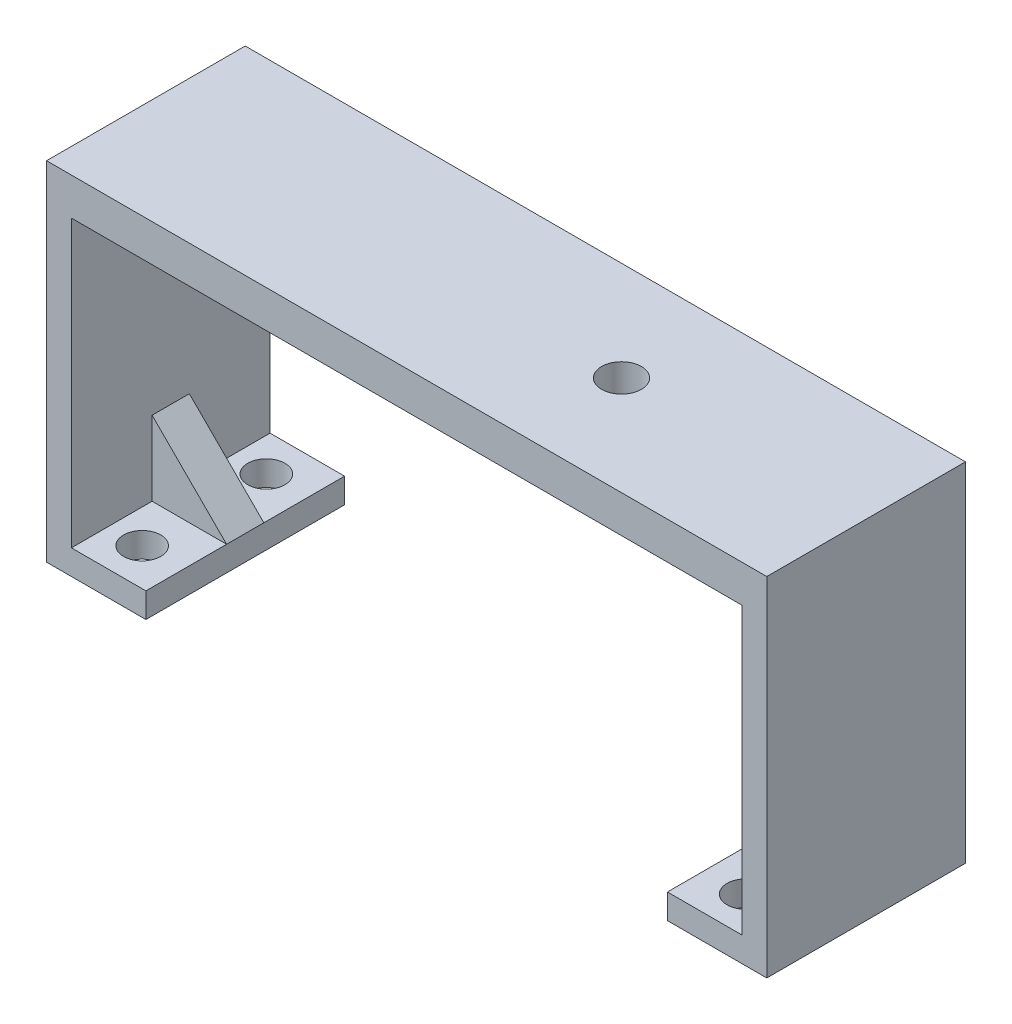
from build123d import *

# Parameters (mm, degrees)
RESSALTO_EXTRUS_O1_DEPTH = 8
ESBO_O2_R                = 1.5
CORTE_EXTRUS_O1_DEPTH    = 16
RESSALTO_EXTRUS_O3_DEPTH = 1.5
ESBO_O6_R                = 1.6
CORTE_EXTRUS_O2_DEPTH    = 3


with BuildPart() as part:
    # Esboço1 → Ressalto-extrusão1 (new, symmetric)
    with BuildSketch(Plane.XY):
        Polygon((-21, 0), (-29, 0), (-29, 28), (29, 28), (29, 0), (21, 0), (21, 2), (27, 2), (27, 25), (-27, 25), (-27, 2), (-21, 2), align=None)
    extrude(amount=RESSALTO_EXTRUS_O1_DEPTH, both=True)

    # Esboço2 → Corte-extrusão1 (cut)
    with BuildSketch(Plane.XZ):
        with Locations(Location((-24.3, -5, 0), (0, 0, 270))):
            Circle(ESBO_O2_R)
        with Locations(Location((-24.3, 5, 0), (0, 0, 270))):
            Circle(ESBO_O2_R)
        with Locations(Location((24.3, 5, 0), (0, 0, 270))):
            Circle(ESBO_O2_R)
        with Locations(Location((24.3, -5, 0), (0, 0, 270))):
            Circle(ESBO_O2_R)
    extrude(amount=-CORTE_EXTRUS_O1_DEPTH, mode=Mode.SUBTRACT)

    # Esboço4 → Ressalto-extrusão3 (add, symmetric)
    with BuildSketch(Plane.XY):
        Polygon((-21, 2), (-27, 8), (-27, 2), align=None)
        Polygon((21, 2), (27, 2), (27, 8), align=None)
    extrude(amount=RESSALTO_EXTRUS_O3_DEPTH, both=True)

    # Esboço6 → Corte-extrusão2 (cut)
    with BuildSketch(Plane(origin=(0, 28, 0), x_dir=(1, 0, 0), z_dir=(0, 1, 0))):
        with Locations(Location((9.3, 0, 0), (0, 0, 270))):
            Circle(ESBO_O6_R)
    extrude(amount=-CORTE_EXTRUS_O2_DEPTH, mode=Mode.SUBTRACT)


solid = part.part
